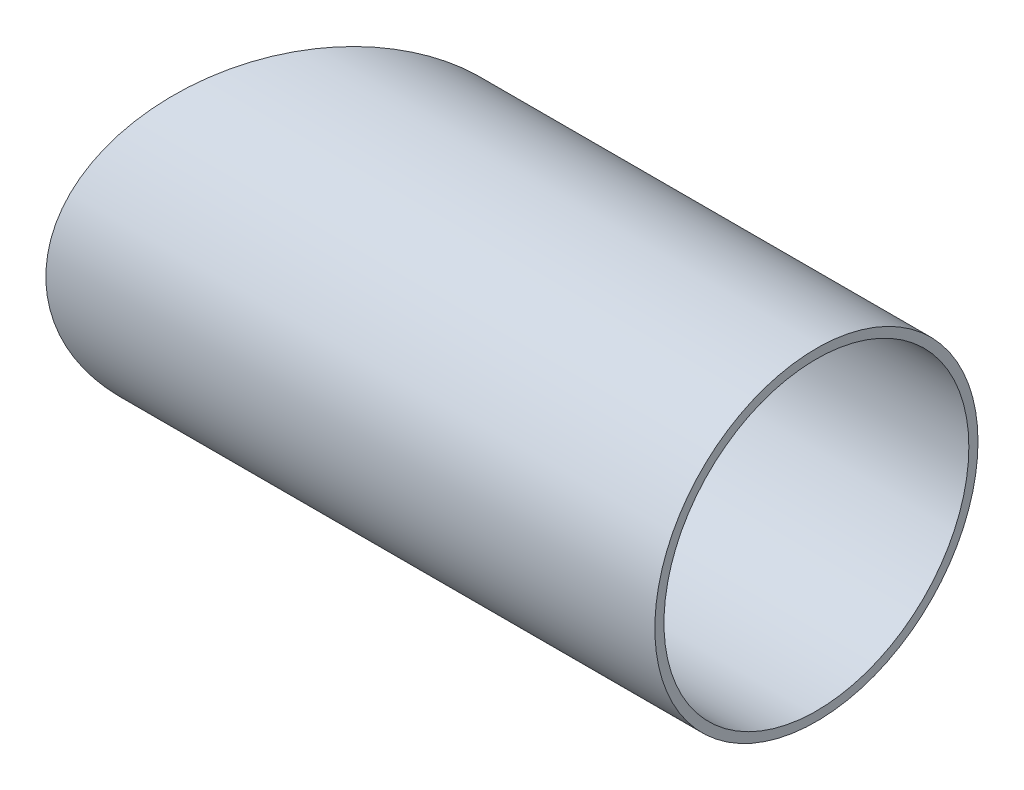
from build123d import *

# Parameters (mm, degrees)
SKETCH3_R              = 53
SKETCH3_R_2            = 50
SPLIT1_SURFACE_1_BACK  = 2303.894
SPLIT1_SURFACE_1_DEPTH = 4607.788


with BuildPart() as part:
    # Sweep1: sweep along a path in Sketch2
    with BuildLine(Plane(origin=(0, 0, 0), x_dir=(1, 0, 0), z_dir=(0, 1, 0))) as sweep1_path:
        Line((-404.145188433, -700), (404.145188433, -700))
        Line((404.145188433, -700), (808.290376865, 0))
        Line((808.290376865, 0), (404.145188433, 700))
        Line((404.145188433, 700), (-404.145188433, 700))
        Line((-404.145188433, 700), (-808.290376865, 0))
        Line((-808.290376865, 0), (-404.145188433, -700))
    # Sketch3 → Sweep1 (sweep)
    with BuildSketch(Plane(origin=(0, 0, 0), x_dir=(0, 0, -1), z_dir=(1, 0, 0))):
        with Locations((-700, 0)):
            Circle(SKETCH3_R)
        with Locations((-700, 0)):
            Circle(SKETCH3_R_2, mode=Mode.SUBTRACT)
    sweep(path=sweep1_path.line, transition=Transition.RIGHT)

    # Split1: cut with a surface, the side behind it stays
    # Split1 surface: a surface, the sketch's curves swept straight by 4607.788 mm
    with BuildLine(Plane(origin=(0, 0, 0), x_dir=(1, 0, 0), z_dir=(0, 1, 0)).offset(-SPLIT1_SURFACE_1_BACK), mode=Mode.PRIVATE) as split1_surface_1_path:
        Line((-487.5, -844.37476869), (-235, -407.031939779))
        Line((-235, -407.031939779), (-235, -946.255779375))
    split1_surface_1 = Shell.extrude(split1_surface_1_path.wire(), (0 * SPLIT1_SURFACE_1_DEPTH, 1 * SPLIT1_SURFACE_1_DEPTH, 0 * SPLIT1_SURFACE_1_DEPTH))
    split(bisect_by=split1_surface_1, keep=Keep.BOTTOM)


solid = part.part
